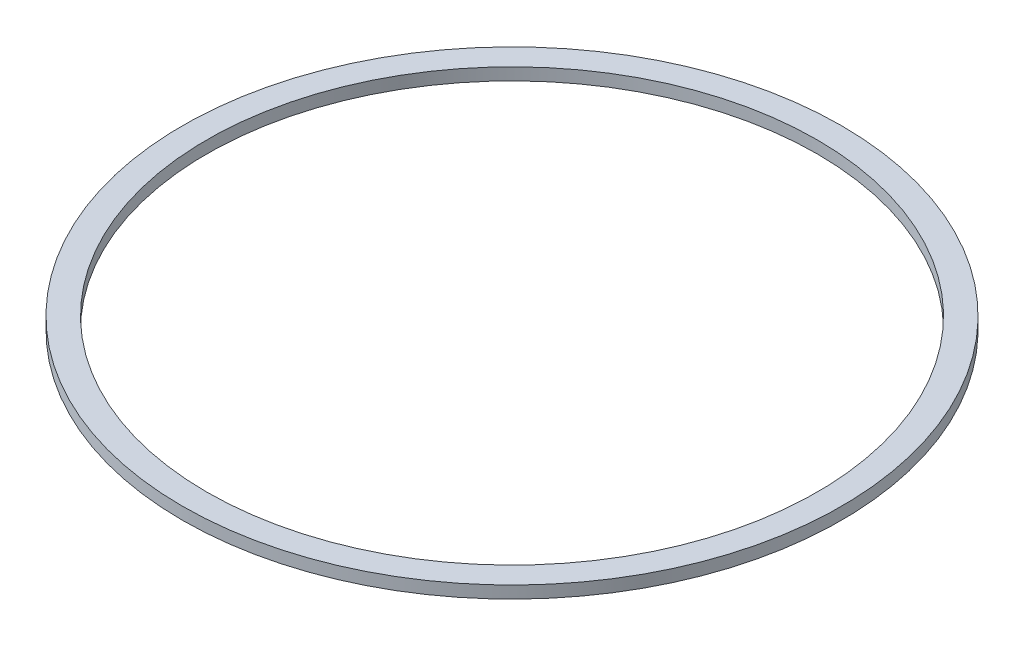
from build123d import *

# Parameters (mm, degrees)
SKETCH1_R           = 27
SKETCH1_R_2         = 25
BOSS_EXTRUDE1_DEPTH = 1


with BuildPart() as part:
    # Sketch1 → Boss-Extrude1 (new body)
    with BuildSketch(Plane(origin=(0, 0, 0), x_dir=(1, 0, 0), z_dir=(0, 1, 0))):
        with Locations(Location((0, 0, 0), (0, 0, 270))):
            Circle(SKETCH1_R)
        with Locations(Location((0, 0, 0), (0, 0, 270))):
            Circle(SKETCH1_R_2, mode=Mode.SUBTRACT)
    extrude(amount=BOSS_EXTRUDE1_DEPTH)


solid = part.part
